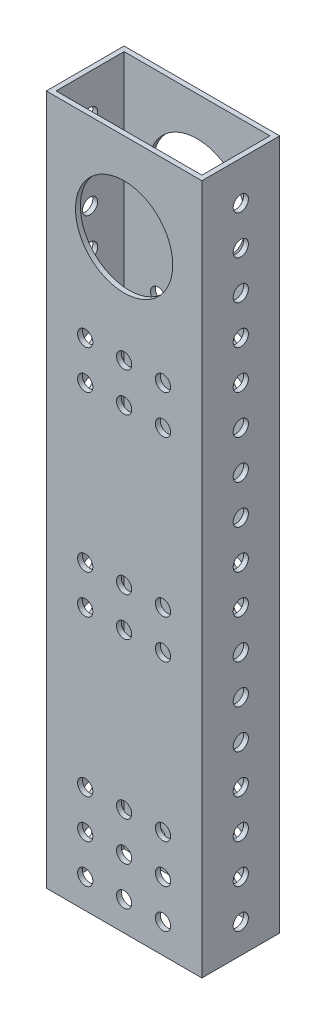
from build123d import *

# Parameters (mm, degrees)
SKETCH1_W           = 50.8
SKETCH1_H           = 225.425
SKETCH1_R           = 15.875
SKETCH1_R_2         = 2.4892
BOSS_EXTRUDE1_DEPTH = 25.4
SKETCH2_R           = 2.4892
CUT_EXTRUDE1_DEPTH  = 233.469848851
SKETCH3_W           = 47.625
SKETCH3_H           = 22.225
CUT_EXTRUDE2_DEPTH  = 233.469848884


with BuildPart() as part:
    # Sketch1 → Boss-Extrude1 (new body)
    with BuildSketch(Plane.XY):
        with Locations((25.4, 112.7125)):
            Rectangle(SKETCH1_W, SKETCH1_H)
        with Locations((25.4, 196.85)):
            Circle(SKETCH1_R, mode=Mode.SUBTRACT)
        with Locations((25.4, 9.525)):
            Circle(SKETCH1_R_2, mode=Mode.SUBTRACT)
        with Locations((38.1, 9.525)):
            Circle(SKETCH1_R_2, mode=Mode.SUBTRACT)
        with Locations((12.7, 9.525)):
            Circle(SKETCH1_R_2, mode=Mode.SUBTRACT)
        with Locations((12.7, 22.225)):
            Circle(SKETCH1_R_2, mode=Mode.SUBTRACT)
        with Locations((25.4, 22.225)):
            Circle(SKETCH1_R_2, mode=Mode.SUBTRACT)
        with Locations((38.1, 22.225)):
            Circle(SKETCH1_R_2, mode=Mode.SUBTRACT)
        with Locations((12.7, 34.925)):
            Circle(SKETCH1_R_2, mode=Mode.SUBTRACT)
        with Locations((25.4, 34.925)):
            Circle(SKETCH1_R_2, mode=Mode.SUBTRACT)
        with Locations((38.1, 34.925)):
            Circle(SKETCH1_R_2, mode=Mode.SUBTRACT)
        with Locations((12.7, 85.725)):
            Circle(SKETCH1_R_2, mode=Mode.SUBTRACT)
        with Locations((25.4, 85.725)):
            Circle(SKETCH1_R_2, mode=Mode.SUBTRACT)
        with Locations((38.1, 85.725)):
            Circle(SKETCH1_R_2, mode=Mode.SUBTRACT)
        with Locations((12.7, 98.425)):
            Circle(SKETCH1_R_2, mode=Mode.SUBTRACT)
        with Locations((25.4, 98.425)):
            Circle(SKETCH1_R_2, mode=Mode.SUBTRACT)
        with Locations((38.1, 98.425)):
            Circle(SKETCH1_R_2, mode=Mode.SUBTRACT)
        with Locations((12.7, 149.225)):
            Circle(SKETCH1_R_2, mode=Mode.SUBTRACT)
        with Locations((25.4, 149.225)):
            Circle(SKETCH1_R_2, mode=Mode.SUBTRACT)
        with Locations((38.1, 149.225)):
            Circle(SKETCH1_R_2, mode=Mode.SUBTRACT)
        with Locations((12.7, 161.925)):
            Circle(SKETCH1_R_2, mode=Mode.SUBTRACT)
        with Locations((25.4, 161.925)):
            Circle(SKETCH1_R_2, mode=Mode.SUBTRACT)
        with Locations((38.1, 161.925)):
            Circle(SKETCH1_R_2, mode=Mode.SUBTRACT)
    extrude(amount=BOSS_EXTRUDE1_DEPTH)

    # Sketch2 → Cut-Extrude1 (cut, through all)
    with BuildSketch(Plane(origin=(50.8, 0, 0), x_dir=(0, 0, -1), z_dir=(1, 0, 0))):
        with Locations((-12.7, 9.525)):
            Circle(SKETCH2_R)
        with Locations((-12.7, 22.225)):
            Circle(SKETCH2_R)
        with Locations((-12.7, 34.925)):
            Circle(SKETCH2_R)
        with Locations((-12.7, 47.625)):
            Circle(SKETCH2_R)
        with Locations((-12.7, 60.325)):
            Circle(SKETCH2_R)
        with Locations((-12.7, 73.025)):
            Circle(SKETCH2_R)
        with Locations((-12.7, 85.725)):
            Circle(SKETCH2_R)
        with Locations((-12.7, 98.425)):
            Circle(SKETCH2_R)
        with Locations((-12.7, 111.125)):
            Circle(SKETCH2_R)
        with Locations((-12.7, 123.825)):
            Circle(SKETCH2_R)
        with Locations((-12.7, 136.525)):
            Circle(SKETCH2_R)
        with Locations((-12.7, 149.225)):
            Circle(SKETCH2_R)
        with Locations((-12.7, 161.925)):
            Circle(SKETCH2_R)
        with Locations((-12.7, 174.625)):
            Circle(SKETCH2_R)
        with Locations((-12.7, 187.325)):
            Circle(SKETCH2_R)
        with Locations((-12.7, 200.025)):
            Circle(SKETCH2_R)
        with Locations((-12.7, 212.725)):
            Circle(SKETCH2_R)
    extrude(amount=-CUT_EXTRUDE1_DEPTH, mode=Mode.SUBTRACT)

    # Sketch3 → Cut-Extrude2 (cut, through all)
    with BuildSketch(Plane(origin=(0, 225.425, 0), x_dir=(1, 0, 0), z_dir=(0, 1, 0))):
        with Locations((25.4, -12.7)):
            Rectangle(SKETCH3_W, SKETCH3_H)
    extrude(amount=-CUT_EXTRUDE2_DEPTH, mode=Mode.SUBTRACT)


solid = part.part
